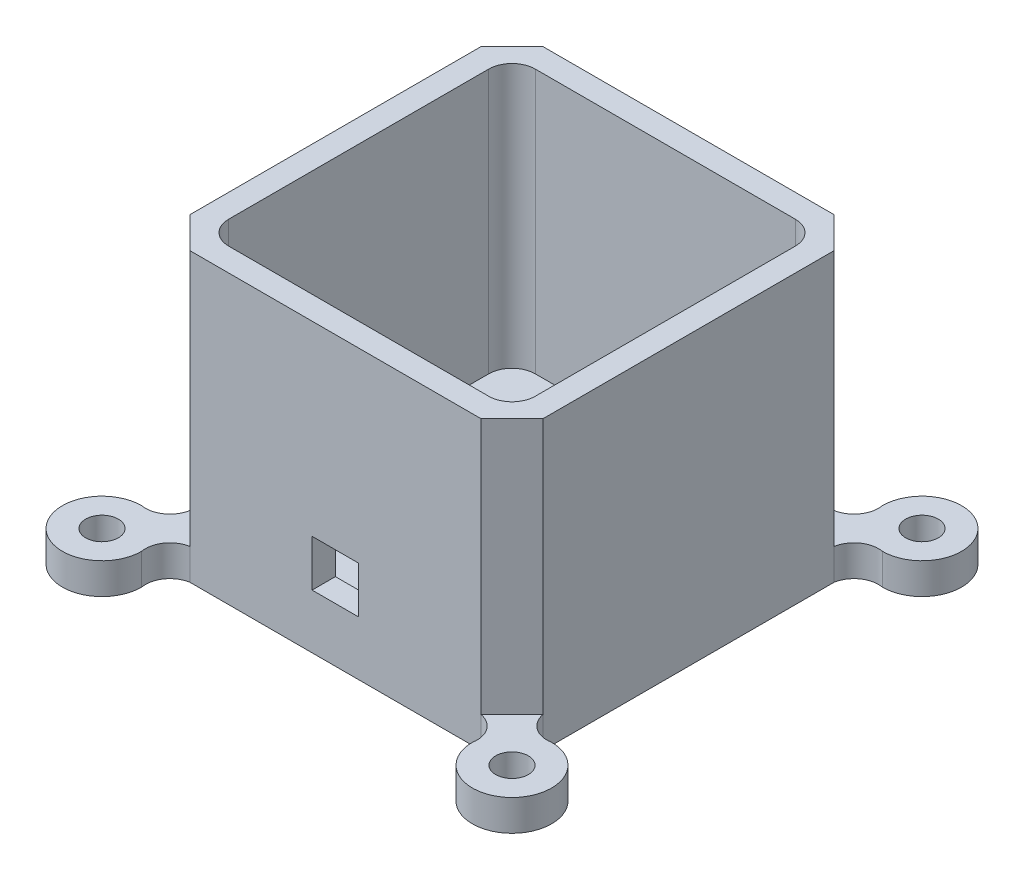
from build123d import *

# Parameters (mm, degrees)
ESTRUSIONE_ESTRUSIONE3_DEPTH = 37
ESTRUSIONE_ESTRUSIONE6_DEPTH = 3
SCHIZZO5_R                   = 2.1
ESTRUSIONE_ESTRUSIONE5_DEPTH = 4
SCHIZZO7_W                   = 6
SCHIZZO7_H                   = 6
TAGLIO_ESTRUSIONE1_DEPTH     = 3


with BuildPart() as part:
    # Schizzo1 → Estrusione-Estrusione3 (new body)
    with BuildSketch(Plane(origin=(0, 0, 0), x_dir=(1, 0, 0), z_dir=(0, 1, 0))):
        Polygon((-18.75, 22.75), (18.75, 22.75), (22.75, 18.75), (22.75, -18.75), (18.75, -22.75), (-18.75, -22.75), (-22.75, -18.75), (-22.75, 18.75), align=None)
        with BuildLine():
            Line((-16.75, 19.75), (16.75, 19.75))
            ThreePointArc((16.75, 19.75), (18.871320344, 18.871320344), (19.75, 16.75))
            Line((19.75, 16.75), (19.75, -16.75))
            ThreePointArc((19.75, -16.75), (18.871320344, -18.871320344), (16.75, -19.75))
            Line((16.75, -19.75), (-16.75, -19.75))
            ThreePointArc((-16.75, -19.75), (-18.871320344, -18.871320344), (-19.75, -16.75))
            Line((-19.75, -16.75), (-19.75, 16.75))
            ThreePointArc((-19.75, 16.75), (-18.871320344, 18.871320344), (-16.75, 19.75))
        make_face(mode=Mode.SUBTRACT)
    extrude(amount=ESTRUSIONE_ESTRUSIONE3_DEPTH)

    # Schizzo6 → Estrusione-Estrusione6 (add)
    with BuildSketch(Plane(origin=(0, 0, 0), x_dir=(1, 0, 0), z_dir=(0, 1, 0))):
        Polygon((-18.75, 22.75), (-22.75, 18.75), (-22.75, -18.75), (-18.75, -22.75), (18.75, -22.75), (22.75, -18.75), (22.75, 18.75), (18.75, 22.75), align=None)
    extrude(amount=ESTRUSIONE_ESTRUSIONE6_DEPTH)

    # Schizzo5 → Estrusione-Estrusione5 (add)
    # profile 1 of 4: a face of its own
    with BuildSketch(Plane(origin=(0, 0, 0), x_dir=(1, 0, 0), z_dir=(0, 1, 0))):
        with BuildLine():
            Line((-22.75, 18.75), (-18.75, 22.75))
            ThreePointArc((-18.75, 22.75), (-20.785786438, 24.048885271), (-21.306854249, 26.406854249))
            ThreePointArc((-21.306854249, 26.406854249), (-30.013098834, 30.013098834), (-26.406854249, 21.306854249))
            ThreePointArc((-26.406854249, 21.306854249), (-24.048885271, 20.785786438), (-22.75, 18.75))
        make_face()
        with Locations(Location((-26.406854249, 26.406854249, 0), (0, 0, 270))):
            Circle(SCHIZZO5_R, mode=Mode.SUBTRACT)
    # profile 2 of 4: a face of its own
    with BuildSketch(Plane(origin=(0, 0, 0), x_dir=(1, 0, 0), z_dir=(0, 1, 0))):
        with BuildLine():
            Line((18.75, 22.75), (22.75, 18.75))
            ThreePointArc((22.75, 18.75), (24.048885271, 20.785786438), (26.406854249, 21.306854249))
            ThreePointArc((26.406854249, 21.306854249), (30.013098834, 30.013098834), (21.306854249, 26.406854249))
            ThreePointArc((21.306854249, 26.406854249), (20.785786438, 24.048885271), (18.75, 22.75))
        make_face()
        with Locations(Location((26.406854249, 26.406854249, 0), (0, 0, 270))):
            Circle(SCHIZZO5_R, mode=Mode.SUBTRACT)
    # profile 3 of 4: a face of its own
    with BuildSketch(Plane(origin=(0, 0, 0), x_dir=(1, 0, 0), z_dir=(0, 1, 0))):
        with BuildLine():
            Line((22.75, -18.75), (18.75, -22.75))
            ThreePointArc((18.75, -22.75), (20.785786438, -24.048885271), (21.306854249, -26.406854249))
            ThreePointArc((21.306854249, -26.406854249), (30.013098834, -30.013098834), (26.406854249, -21.306854249))
            ThreePointArc((26.406854249, -21.306854249), (24.048885271, -20.785786438), (22.75, -18.75))
        make_face()
        with Locations(Location((26.406854249, -26.406854249, 0), (0, 0, 270))):
            Circle(SCHIZZO5_R, mode=Mode.SUBTRACT)
    # profile 4 of 4: a face of its own
    with BuildSketch(Plane(origin=(0, 0, 0), x_dir=(1, 0, 0), z_dir=(0, 1, 0))):
        with BuildLine():
            Line((-18.75, -22.75), (-22.75, -18.75))
            ThreePointArc((-22.75, -18.75), (-24.048885271, -20.785786438), (-26.406854249, -21.306854249))
            ThreePointArc((-26.406854249, -21.306854249), (-30.013098834, -30.013098834), (-21.306854249, -26.406854249))
            ThreePointArc((-21.306854249, -26.406854249), (-20.785786438, -24.048885271), (-18.75, -22.75))
        make_face()
        with Locations(Location((-26.406854249, -26.406854249, 0), (0, 0, 270))):
            Circle(SCHIZZO5_R, mode=Mode.SUBTRACT)
    extrude(amount=ESTRUSIONE_ESTRUSIONE5_DEPTH)

    # Schizzo7 → Taglio-Estrusione1 (cut)
    with BuildSketch(Plane.XY.offset(22.75)):
        with Locations((0, 10)):
            Rectangle(SCHIZZO7_W, SCHIZZO7_H)
    extrude(amount=-TAGLIO_ESTRUSIONE1_DEPTH, mode=Mode.SUBTRACT)


solid = part.part
